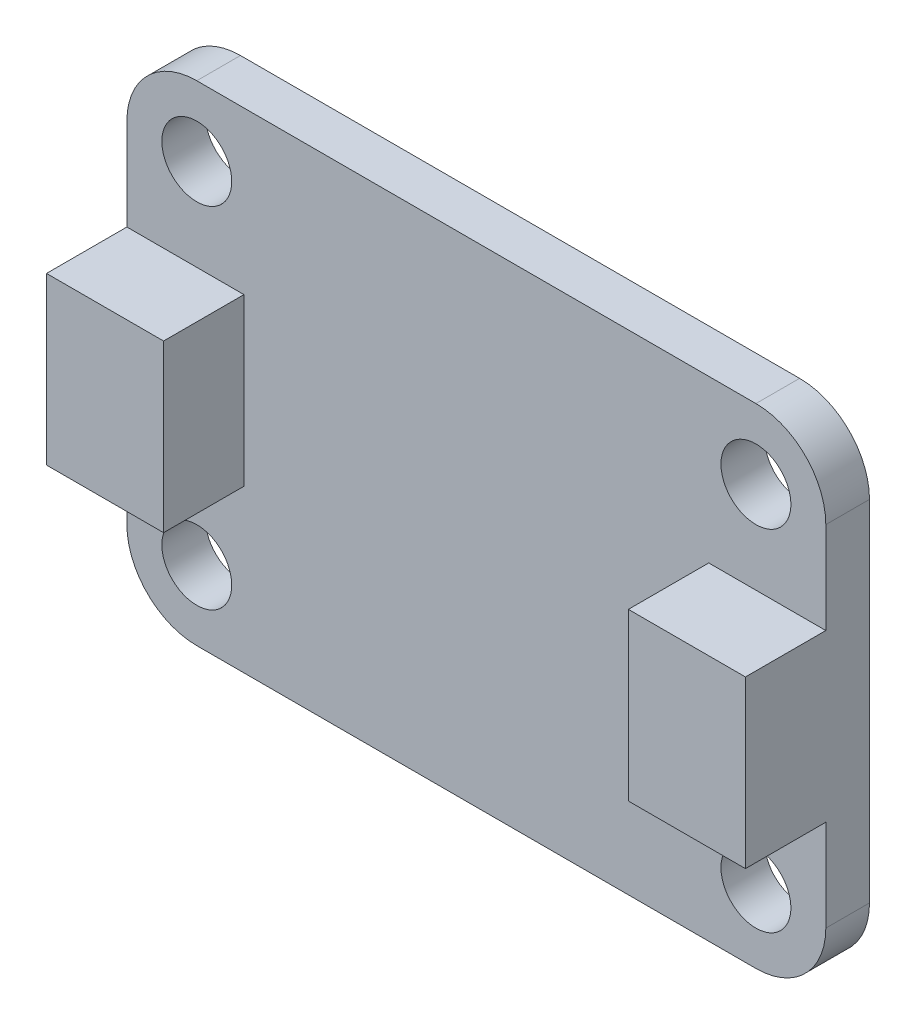
from build123d import *

# Parameters (mm, degrees)
SKETCH1_W           = 25.4
SKETCH1_H           = 17.78
BOSS_EXTRUDE1_DEPTH = 0.79375
SKETCH2_W           = 4.2545
SKETCH2_H           = 6.0325
BOSS_EXTRUDE2_DEPTH = 2.921
SKETCH3_R           = 1.27
CUT_EXTRUDE1_DEPTH  = 16.775117781
FILLET1_R           = 2.54


with BuildPart() as part:
    # Sketch1 → Boss-Extrude1 (new, symmetric)
    with BuildSketch(Plane.XY):
        Rectangle(SKETCH1_W, SKETCH1_H)
    extrude(amount=BOSS_EXTRUDE1_DEPTH, both=True)

    # Sketch2 → Boss-Extrude2 (add)
    with BuildSketch(Plane.XY.offset(0.79375)):
        with Locations((10.57275, 0)):
            Rectangle(SKETCH2_W, SKETCH2_H)
        with Locations((-10.57275, 0)):
            Rectangle(SKETCH2_W, SKETCH2_H)
    extrude(amount=BOSS_EXTRUDE2_DEPTH)

    # Sketch3 → Cut-Extrude1 (cut, through all)
    with BuildSketch(Plane.XY.offset(0.79375)):
        with Locations((-10.16, 6.35)):
            Circle(SKETCH3_R)
        with Locations((-10.16, -6.35)):
            Circle(SKETCH3_R)
        with Locations(Location((10.16, -6.35, 0), (0, 0, 180))):
            Circle(SKETCH3_R)
        with Locations(Location((10.16, 6.35, 0), (0, 0, 180))):
            Circle(SKETCH3_R)
    extrude(amount=-CUT_EXTRUDE1_DEPTH, mode=Mode.SUBTRACT)

    # Fillet1
    fillet1_edges = [part.edges().sort_by_distance(p)[0] for p in [
        (12.7, -8.89, 0),
        (-12.7, -8.89, 0),
        (-12.7, 8.89, 0),
        (12.7, 8.89, 0),
    ]]
    fillet(fillet1_edges, radius=FILLET1_R)


solid = part.part
